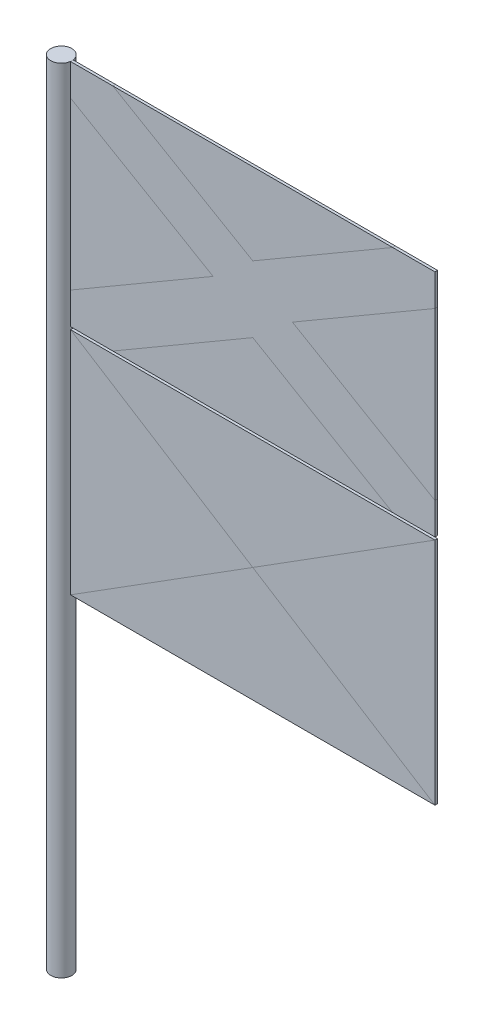
from build123d import *

# Parameters (mm, degrees)
ESQUISSE2_W                  = 69
ESQUISSE2_H                  = 43.47826087
BOSS_EXTRU_2_DEPTH           = 0.25
ESQUISSE2_H_2                = 43.478260869
BOSS_EXTRU_2_2_DEPTH         = 0.25
ESQUISSE3_R                  = 2
BOSS_EXTRU_3_DEPTH           = 150
FRACTIONNER1_SURFACE_1_BACK  = 167.868
FRACTIONNER1_SURFACE_1_DEPTH = 335.736
FRACTIONNER1_SURFACE_2_BACK  = 167.868
FRACTIONNER1_SURFACE_2_DEPTH = 335.736
FRACTIONNER2_SURFACE_3_BACK  = 167.868
FRACTIONNER2_SURFACE_3_DEPTH = 335.736
FRACTIONNER2_SURFACE_4_BACK  = 167.868
FRACTIONNER2_SURFACE_4_DEPTH = 335.736
FRACTIONNER3_SURFACE_5_BACK  = 167.868
FRACTIONNER3_SURFACE_5_DEPTH = 335.736
FRACTIONNER3_SURFACE_6_BACK  = 167.868
FRACTIONNER3_SURFACE_6_DEPTH = 335.736


with BuildPart() as part:
    # Esquisse2 → Boss.-Extru.2 (new, symmetric)
    with BuildSketch(Plane.XY):
        with Locations((36.5, -21.739130435)):
            Rectangle(ESQUISSE2_W, ESQUISSE2_H)
    extrude(amount=BOSS_EXTRU_2_DEPTH, both=True)


with BuildPart() as body_2:
    # Esquisse2 → Boss.-Extru.2 2 (new, symmetric)
    with BuildSketch(Plane.XY):
        with Locations((36.5, -65.717391305)):
            Rectangle(ESQUISSE2_W, ESQUISSE2_H_2)
    extrude(amount=BOSS_EXTRU_2_2_DEPTH, both=True)


with BuildPart() as body_3:
    # Esquisse3 → Boss.-Extru.3 (new body)
    with BuildSketch(Plane(origin=(0, 0, 0), x_dir=(1, 0, 0), z_dir=(0, 1, 0))):
        with Locations(Location((0, 0, 0), (0, 0, 270))):
            Circle(ESQUISSE3_R)
    extrude(amount=-BOSS_EXTRU_3_DEPTH)


with BuildPart() as body_4:
    # Fractionner1: the piece behind the surface
    add(part.part)
    # Fractionner1 surface: a surface, the sketch's curves swept straight by 335.736 mm
    with BuildLine(Plane.XY.offset(0.25).offset(-FRACTIONNER1_SURFACE_1_BACK), mode=Mode.PRIVATE) as fractionner1_surface_1_path:
        Line((10, 0), (36.5, -15.447665056))
        Line((36.5, -15.447665056), (63, 0))
        Line((63, 0), (71, 0))
        Line((71, 0), (71, -6))
        Line((71, -6), (44, -21.739130435))
        Line((44, -21.739130435), (71, -37.47826087))
        Line((71, -37.47826087), (71, -43.47826087))
        Line((71, -43.47826087), (63, -43.47826087))
        Line((63, -43.47826087), (36.5, -28.030595813))
        Line((36.5, -28.030595813), (10, -43.47826087))
        Line((10, -43.47826087), (2, -43.47826087))
        Line((2, -43.47826087), (2, -37.47826087))
        Line((2, -37.47826087), (29, -21.739130435))
        Line((29, -21.739130435), (2, -6))
        Line((2, -6), (2, 0))
        Line((2, 0), (10, 0))
    fractionner1_surface_1 = Shell.extrude(fractionner1_surface_1_path.wire(), (0 * FRACTIONNER1_SURFACE_1_DEPTH, 0 * FRACTIONNER1_SURFACE_1_DEPTH, 1 * FRACTIONNER1_SURFACE_1_DEPTH))
    split(bisect_by=fractionner1_surface_1, keep=Keep.BOTTOM)


with BuildPart() as part_1:
    add(part.part)

    # Fractionner1: split by a surface, the side it looks to stays
    # Fractionner1 surface: a surface, the sketch's curves swept straight by 335.736 mm
    with BuildLine(Plane.XY.offset(0.25).offset(-FRACTIONNER1_SURFACE_2_BACK), mode=Mode.PRIVATE) as fractionner1_surface_2_path:
        Line((10, 0), (36.5, -15.447665056))
        Line((36.5, -15.447665056), (63, 0))
        Line((63, 0), (71, 0))
        Line((71, 0), (71, -6))
        Line((71, -6), (44, -21.739130435))
        Line((44, -21.739130435), (71, -37.47826087))
        Line((71, -37.47826087), (71, -43.47826087))
        Line((71, -43.47826087), (63, -43.47826087))
        Line((63, -43.47826087), (36.5, -28.030595813))
        Line((36.5, -28.030595813), (10, -43.47826087))
        Line((10, -43.47826087), (2, -43.47826087))
        Line((2, -43.47826087), (2, -37.47826087))
        Line((2, -37.47826087), (29, -21.739130435))
        Line((29, -21.739130435), (2, -6))
        Line((2, -6), (2, 0))
        Line((2, 0), (10, 0))
    fractionner1_surface_2 = Shell.extrude(fractionner1_surface_2_path.wire(), (0 * FRACTIONNER1_SURFACE_2_DEPTH, 0 * FRACTIONNER1_SURFACE_2_DEPTH, 1 * FRACTIONNER1_SURFACE_2_DEPTH))
    split(bisect_by=fractionner1_surface_2, keep=Keep.TOP)


with BuildPart() as body_5:
    # Fractionner2: the piece behind the surface
    add(body_2.part)
    # Fractionner2 surface: a surface, the sketch's curves swept straight by 335.736 mm
    with BuildLine(Plane.XY.offset(0.25).offset(-FRACTIONNER2_SURFACE_3_BACK), mode=Mode.PRIVATE) as fractionner2_surface_3_path:
        Line((2, -43.97826087), (71, -43.97826087))
        Line((71, -43.97826087), (36.5, -65.717391304))
        Line((36.5, -65.717391304), (2, -43.97826087))
    fractionner2_surface_3 = Shell.extrude(fractionner2_surface_3_path.wire(), (0 * FRACTIONNER2_SURFACE_3_DEPTH, 0 * FRACTIONNER2_SURFACE_3_DEPTH, 1 * FRACTIONNER2_SURFACE_3_DEPTH))
    split(bisect_by=fractionner2_surface_3, keep=Keep.BOTTOM)


with BuildPart() as body_2_1:
    add(body_2.part)

    # Fractionner2: split by a surface, the side it looks to stays
    # Fractionner2 surface: a surface, the sketch's curves swept straight by 335.736 mm
    with BuildLine(Plane.XY.offset(0.25).offset(-FRACTIONNER2_SURFACE_4_BACK), mode=Mode.PRIVATE) as fractionner2_surface_4_path:
        Line((2, -43.97826087), (71, -43.97826087))
        Line((71, -43.97826087), (36.5, -65.717391304))
        Line((36.5, -65.717391304), (2, -43.97826087))
    fractionner2_surface_4 = Shell.extrude(fractionner2_surface_4_path.wire(), (0 * FRACTIONNER2_SURFACE_4_DEPTH, 0 * FRACTIONNER2_SURFACE_4_DEPTH, 1 * FRACTIONNER2_SURFACE_4_DEPTH))
    split(bisect_by=fractionner2_surface_4, keep=Keep.TOP)


with BuildPart() as body_6:
    # Fractionner3: the piece behind the surface
    add(body_2_1.part)
    # Fractionner3 surface: a surface, the sketch's curves swept straight by 335.736 mm
    with BuildLine(Plane.XY.offset(0.25).offset(-FRACTIONNER3_SURFACE_5_BACK), mode=Mode.PRIVATE) as fractionner3_surface_5_path:
        Line((2, -87.456521739), (36.5, -65.717391304))
        Line((36.5, -65.717391304), (71, -87.456521739))
        Line((71, -87.456521739), (2, -87.456521739))
    fractionner3_surface_5 = Shell.extrude(fractionner3_surface_5_path.wire(), (0 * FRACTIONNER3_SURFACE_5_DEPTH, 0 * FRACTIONNER3_SURFACE_5_DEPTH, 1 * FRACTIONNER3_SURFACE_5_DEPTH))
    split(bisect_by=fractionner3_surface_5, keep=Keep.BOTTOM)


with BuildPart() as body_2_2:
    add(body_2_1.part)

    # Fractionner3: split by a surface, the side it looks to stays
    # Fractionner3 surface: a surface, the sketch's curves swept straight by 335.736 mm
    with BuildLine(Plane.XY.offset(0.25).offset(-FRACTIONNER3_SURFACE_6_BACK), mode=Mode.PRIVATE) as fractionner3_surface_6_path:
        Line((2, -87.456521739), (36.5, -65.717391304))
        Line((36.5, -65.717391304), (71, -87.456521739))
        Line((71, -87.456521739), (2, -87.456521739))
    fractionner3_surface_6 = Shell.extrude(fractionner3_surface_6_path.wire(), (0 * FRACTIONNER3_SURFACE_6_DEPTH, 0 * FRACTIONNER3_SURFACE_6_DEPTH, 1 * FRACTIONNER3_SURFACE_6_DEPTH))
    split(bisect_by=fractionner3_surface_6, keep=Keep.TOP)


solid = Compound([body_3.part, body_4.part, part_1.part, body_5.part, body_6.part, body_2_2.part])
